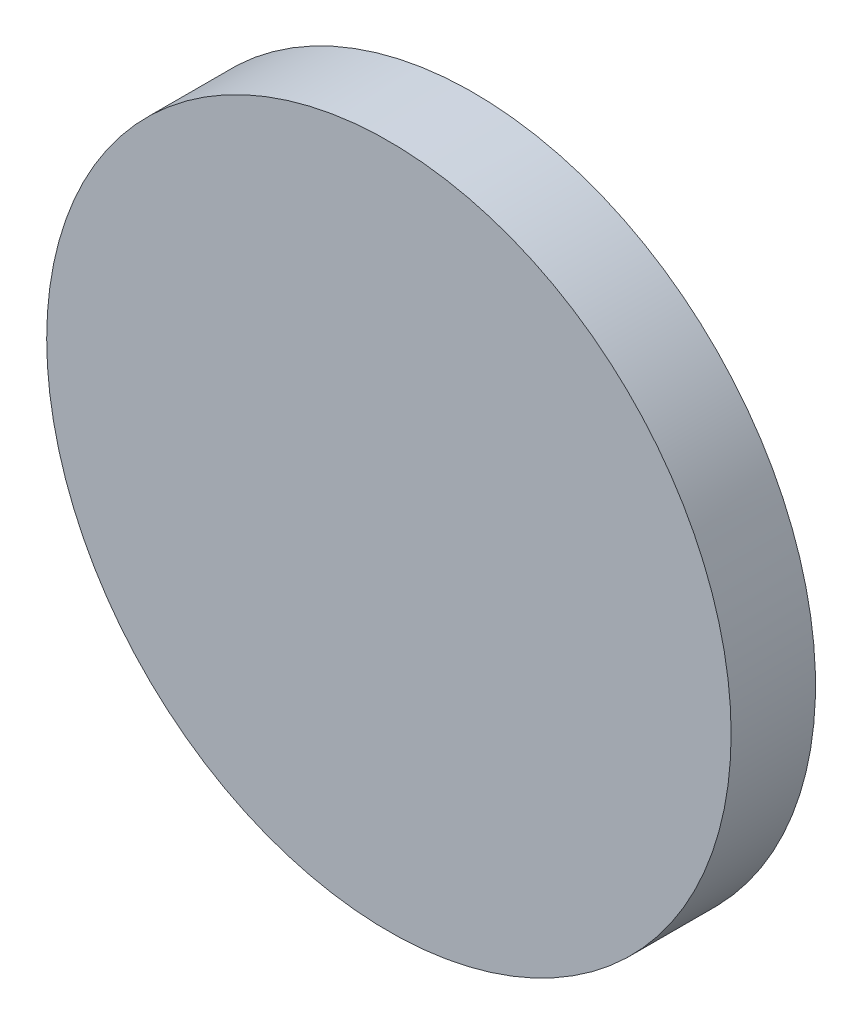
from build123d import *

# Parameters (mm, degrees)
SKETCH_1_R          = 25.5
SKETCH_1_R_2        = 23.5
EXTRUDE_2_DEPTH     = 15
SKETCH_3_R          = 36.5
SKETCH_3_R_2        = 29.5
EXTRUDE_3_DEPTH     = 15
SKETCH_6_R          = 47.852289075
CUT_EXTRUDE_1_DEPTH = 8
SKETCH_9_R          = 36.5
EXTRUDE_5_DEPTH     = 2


with BuildPart() as part:
    # 草图1 → 凸台-拉伸2 (new body)
    with BuildSketch(Plane.XY):
        Circle(SKETCH_1_R)
        Circle(SKETCH_1_R_2, mode=Mode.SUBTRACT)
    extrude(amount=EXTRUDE_2_DEPTH)


with BuildPart() as body_2:
    # 草图3 → 凸台-拉伸3 (new body)
    with BuildSketch(Plane.XY):
        Circle(SKETCH_3_R)
        Circle(SKETCH_3_R_2, mode=Mode.SUBTRACT)
    extrude(amount=EXTRUDE_3_DEPTH)

    # 草图5 → 切除-旋转2 (revolve, cut)
    with BuildSketch(Plane(origin=(0, 0, 0), x_dir=(1, 0, 0), z_dir=(0, 1, 0))):
        with BuildLine():
            Line((-29.5, -3), (-29.5, -13))
            ThreePointArc((-29.5, -13), (-34.5, -8), (-29.5, -3))
        make_face()
    revolve(axis=Axis((0, 0, 0), (0, 0, 1)), mode=Mode.SUBTRACT)


with BuildPart() as cut_extrude_1_tool:
    # 草图6 → 切除-拉伸1 (new body)
    with BuildSketch(Plane(origin=(0, 0, 0), x_dir=(-1, 0, 0), z_dir=(0, 0, -1))):
        Circle(SKETCH_6_R)
    extrude(amount=-CUT_EXTRUDE_1_DEPTH)


with BuildPart() as part_1:
    add(part.part)

    # 切除-拉伸1: cut by cut_extrude_1_tool
    add(cut_extrude_1_tool.part, mode=Mode.SUBTRACT)



with BuildPart() as body_2_1:
    add(body_2.part)

    # 切除-拉伸1: cut by cut_extrude_1_tool
    add(cut_extrude_1_tool.part, mode=Mode.SUBTRACT)


with BuildPart() as part_2:
    add(part_1.part)

    add(body_2_1.part)  # 凸台-拉伸5 merges body 2
    # 草图9 → 凸台-拉伸5 (add)
    with BuildSketch(Plane.XY.offset(15)):
        with Locations(Location((0, 0, 0), (0, 0, 180))):
            Circle(SKETCH_9_R)
    extrude(amount=EXTRUDE_5_DEPTH)


solid = part_2.part
